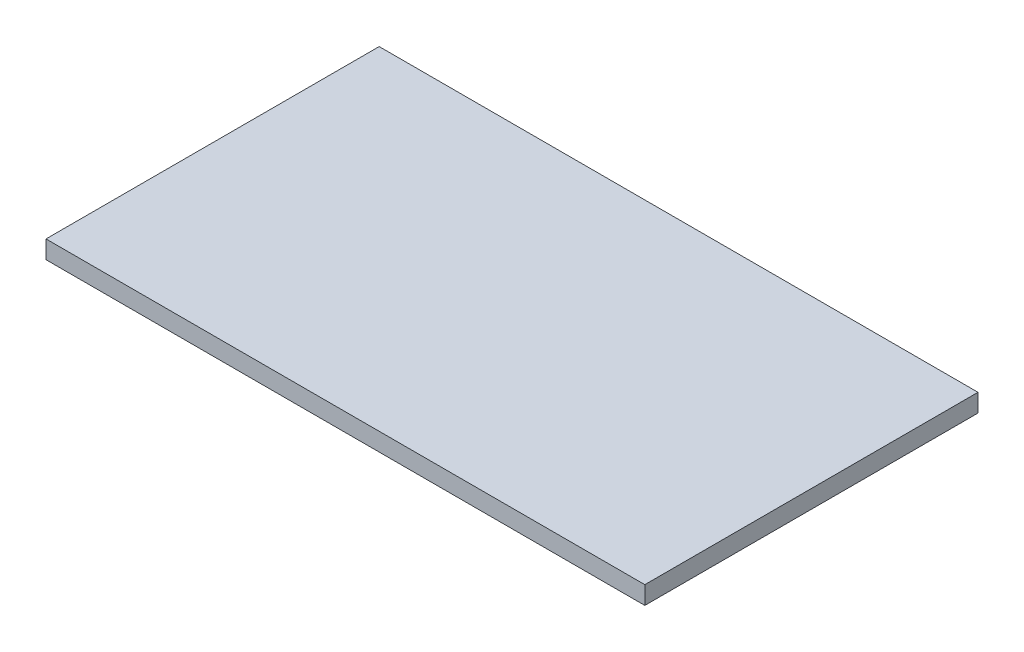
from build123d import *

# Parameters (mm, degrees)
SKETCH_1_W      = 133
SKETCH_1_H      = 74
EXTRUDE_1_DEPTH = 4


with BuildPart() as part:
    # 草图1 → 凸台-拉伸1 (new body)
    with BuildSketch(Plane(origin=(0, 0, 0), x_dir=(1, 0, 0), z_dir=(0, 1, 0))):
        with Locations((66.5, -37)):
            Rectangle(SKETCH_1_W, SKETCH_1_H)
    extrude(amount=EXTRUDE_1_DEPTH)


solid = part.part
